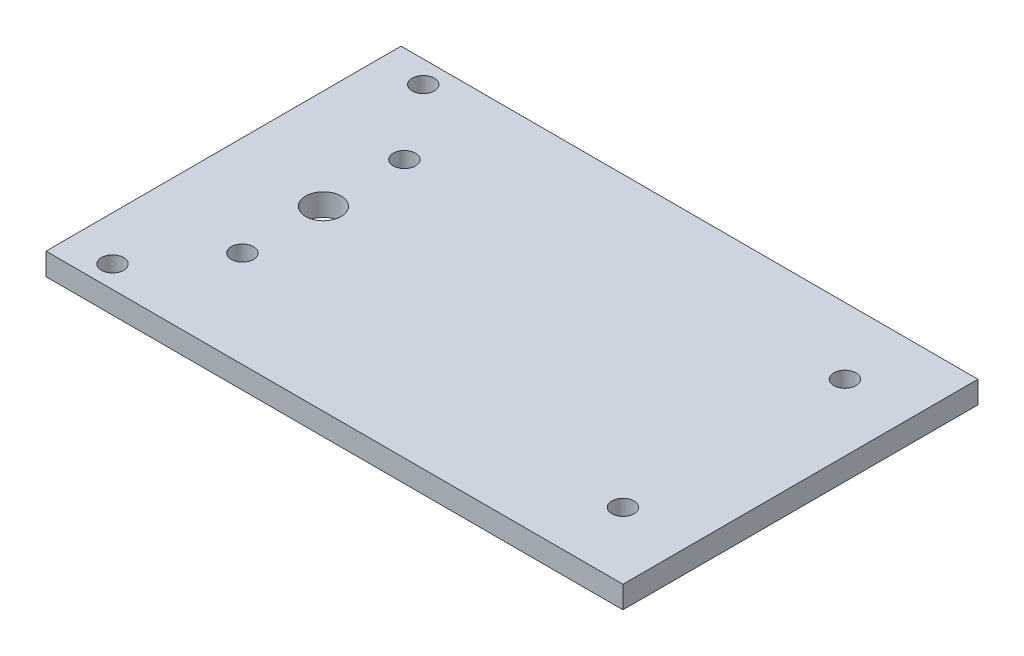
from build123d import *

# Parameters (mm, degrees)
SKETCH1_W           = 130
SKETCH1_H           = 80
SKETCH1_R           = 4
SKETCH1_R_2         = 2.5
BOSS_EXTRUDE1_DEPTH = 5


with BuildPart() as part:
    # Sketch1 → Boss-Extrude1 (new body)
    with BuildSketch(Plane(origin=(0, 0, 0), x_dir=(1, 0, 0), z_dir=(0, 1, 0))):
        with Locations((-4.718309859, -5.352112676)):
            Rectangle(SKETCH1_W, SKETCH1_H)
        with Locations(Location((-47.218309859, -5.352112676, 0), (0, 0, 270))):
            Circle(SKETCH1_R, mode=Mode.SUBTRACT)
        with Locations(Location((45.281690141, 19.647887324, 0), (0, 0, 270))):
            Circle(SKETCH1_R_2, mode=Mode.SUBTRACT)
        with Locations(Location((-59.718309859, 29.647887324, 0), (0, 0, 270))):
            Circle(SKETCH1_R_2, mode=Mode.SUBTRACT)
        with Locations(Location((45.281690141, -30.352112676, 0), (0, 0, 90))):
            Circle(SKETCH1_R_2, mode=Mode.SUBTRACT)
        with Locations(Location((-59.718309859, -40.352112676, 0), (0, 0, 90))):
            Circle(SKETCH1_R_2, mode=Mode.SUBTRACT)
        with Locations(Location((-47.218309859, 12.897887324, 0), (0, 0, 270))):
            Circle(SKETCH1_R_2, mode=Mode.SUBTRACT)
        with Locations(Location((-47.218309859, -23.602112676, 0), (0, 0, 90))):
            Circle(SKETCH1_R_2, mode=Mode.SUBTRACT)
    extrude(amount=BOSS_EXTRUDE1_DEPTH)


solid = part.part
